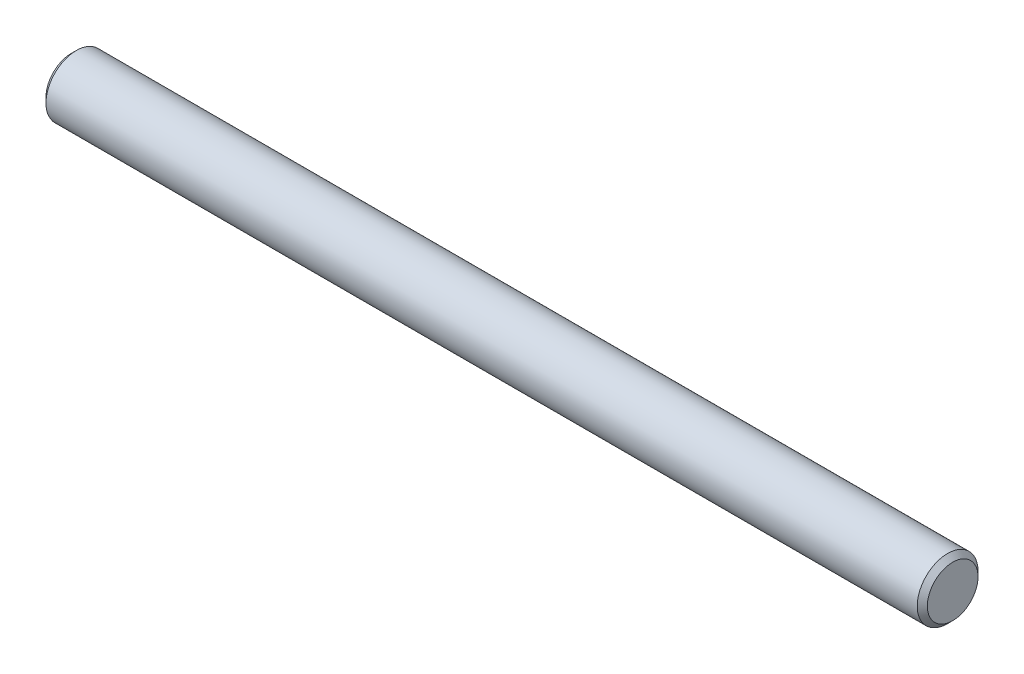
from build123d import *

# Parameters (mm, degrees)
SKETCH1_R           = 6
BOSS_EXTRUDE1_DEPTH = 174
CHAMFER1_SIZE       = 1


with BuildPart() as part:
    # Sketch1 → Boss-Extrude1 (new body)
    with BuildSketch(Plane(origin=(0, 0, 0), x_dir=(0, 0, -1), z_dir=(1, 0, 0))):
        Circle(SKETCH1_R)
    extrude(amount=BOSS_EXTRUDE1_DEPTH)

    # Chamfer1
    chamfer1_edges = [part.edges().sort_by_distance(p)[0] for p in [
        (0, 0, 6),
        (174, 0, 6),
    ]]
    chamfer(chamfer1_edges, length=CHAMFER1_SIZE)


solid = part.part
